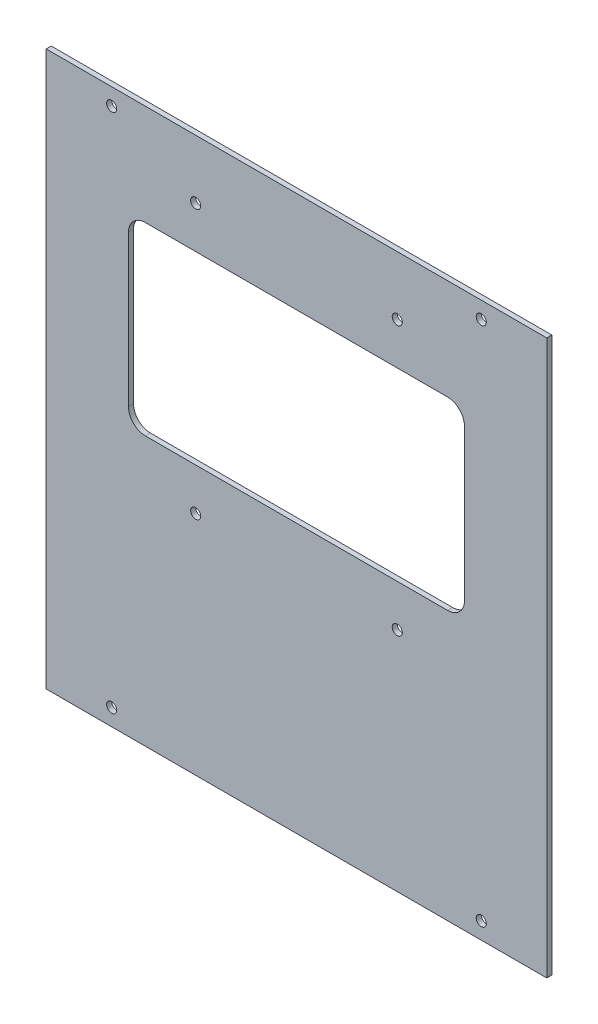
from build123d import *

# Parameters (mm, degrees)
ESQUISSE1_W             = 149
ESQUISSE1_H             = 165
ESQUISSE1_W_2           = 100
ESQUISSE1_H_2           = 55
BOSS_EXTRU_1_DEPTH      = 1.5
CONG_1_R                = 5
ESQUISSE2_R             = 1.5
ENL_V_MAT_EXTRU_1_DEPTH = 182.045574373


with BuildPart() as part:
    # Esquisse1 → Boss.-Extru.1 (new body)
    with BuildSketch(Plane.XY):
        with Locations((0, 82.5)):
            Rectangle(ESQUISSE1_W, ESQUISSE1_H)
        with Locations((0, 107.5)):
            Rectangle(ESQUISSE1_W_2, ESQUISSE1_H_2, mode=Mode.SUBTRACT)
    extrude(amount=BOSS_EXTRU_1_DEPTH)

    # Congé1
    cong_1_edges = [part.edges().sort_by_distance(p)[0] for p in [
        (-50, 135, 0.75),
        (-50, 80, 0.75),
        (50, 80, 0.75),
        (50, 135, 0.75),
    ]]
    fillet(cong_1_edges, radius=CONG_1_R)

    # Esquisse2 → Enlèv. mat.-Extru.1 (cut, through all)
    with BuildSketch(Plane.XY.offset(1.5)):
        with Locations((-30, 147.5)):
            Circle(ESQUISSE2_R)
        with Locations(Location((-30, 67.5, 0), (0, 0, 180))):
            Circle(ESQUISSE2_R)
        with Locations((30, 67.5)):
            Circle(ESQUISSE2_R)
        with Locations(Location((30, 147.5, 0), (0, 0, 180))):
            Circle(ESQUISSE2_R)
        with Locations((-55, 160)):
            Circle(ESQUISSE2_R)
        with Locations(Location((-55, 5, 0), (0, 0, 180))):
            Circle(ESQUISSE2_R)
        with Locations((55, 5)):
            Circle(ESQUISSE2_R)
        with Locations(Location((55, 160, 0), (0, 0, 180))):
            Circle(ESQUISSE2_R)
    extrude(amount=-ENL_V_MAT_EXTRU_1_DEPTH, mode=Mode.SUBTRACT)


solid = part.part
